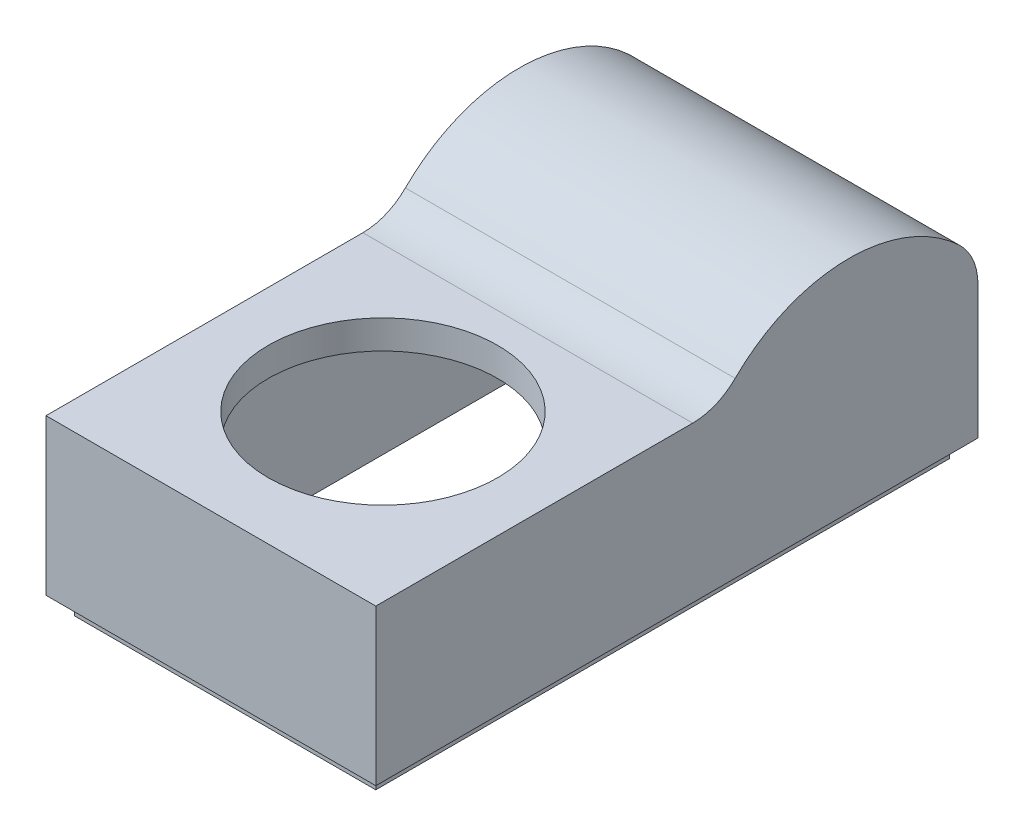
from build123d import *

# Parameters (mm, degrees)
SKETCH1_W           = 29.21
SKETCH1_H           = 53.34
BOSS_EXTRUDE1_DEPTH = 9.74725
CUT_EXTRUDE1_DEPTH  = 29.21
FILLET1_R           = 5.334
FILLET2_R           = 5.334
SHELL1_T            = -2.54
SKETCH3_R           = 10.16
CUT_EXTRUDE2_DEPTH  = 24.13
SKETCH5_W           = 10.795
SKETCH5_H           = 1.5875
CUT_EXTRUDE3_DEPTH  = 2.54
BOSS_EXTRUDE2_DEPTH = 1.5875


with BuildPart() as part:
    # Sketch1 → Boss-Extrude1 (new, symmetric)
    with BuildSketch(Plane(origin=(0, 0, 0), x_dir=(1, 0, 0), z_dir=(0, 1, 0))):
        Rectangle(SKETCH1_W, SKETCH1_H)
    extrude(amount=BOSS_EXTRUDE1_DEPTH, both=True)

    # Sketch2 → Cut-Extrude1 (cut)
    with BuildSketch(Plane(origin=(14.605, 0, 0), x_dir=(0, 0, -1), z_dir=(1, 0, 0))):
        with BuildLine():
            Line((-26.67, 9.74725), (-26.67, 4.03225))
            Line((-26.67, 4.03225), (3.81, 4.03225))
            ThreePointArc((3.81, 4.03225), (8.850435754, 8.238878491), (15.24, 9.74725))
            Line((15.24, 9.74725), (-26.67, 9.74725))
        make_face()
        with BuildLine():
            Line((26.67, 9.74725), (15.24, 9.74725))
            ThreePointArc((15.24, 9.74725), (21.629564246, 8.238878491), (26.67, 4.03225))
            Line((26.67, 4.03225), (26.67, 9.74725))
        make_face()
    extrude(amount=-CUT_EXTRUDE1_DEPTH, mode=Mode.SUBTRACT)

    # Fillet1
    fillet1_edges = [part.edges().sort_by_distance(p)[0] for p in [
        (0, 4.03225, -3.81),
    ]]
    fillet(fillet1_edges, radius=FILLET1_R)

    # Fillet2
    fillet2_edges = [part.edges().sort_by_distance(p)[0] for p in [
        (0, 4.03225, -26.67),
    ]]
    fillet(fillet2_edges, radius=FILLET2_R)

    # Shell1
    shell1_openings = [part.faces().sort_by_distance(p)[0] for p in [
        (0, -9.74725, 0),
    ]]
    offset(amount=SHELL1_T, openings=shell1_openings, kind=Kind.INTERSECTION)

    # Sketch3 → Cut-Extrude2 (cut)
    with BuildSketch(Plane(origin=(0, 4.03225, 0), x_dir=(1, 0, 0), z_dir=(0, 1, 0))):
        with Locations(Location((0, -11.43, 0), (0, 0, 270))):
            Circle(SKETCH3_R)
    extrude(amount=-CUT_EXTRUDE2_DEPTH, mode=Mode.SUBTRACT)

    # Sketch5 → Cut-Extrude3 (cut)
    with BuildSketch(Plane(origin=(0, 0, -26.67), x_dir=(-1, 0, 0), z_dir=(0, 0, -1))):
        with Locations((0, -8.9535)):
            Rectangle(SKETCH5_W, SKETCH5_H)
    extrude(amount=-CUT_EXTRUDE3_DEPTH, mode=Mode.SUBTRACT)

    # Sketch4 → Boss-Extrude2 (add)
    with BuildSketch(Plane.XZ.offset(9.74725)):
        Polygon((-5.3975, -24.13), (-12.065, -24.13), (-12.065, 24.13), (12.065, 24.13), (12.065, -24.13), (5.3975, -24.13), (5.3975, -25.4), (13.335, -25.4), (13.335, 25.4), (-13.335, 25.4), (-13.335, -25.4), (-5.3975, -25.4), align=None)
    extrude(amount=BOSS_EXTRUDE2_DEPTH)


solid = part.part
